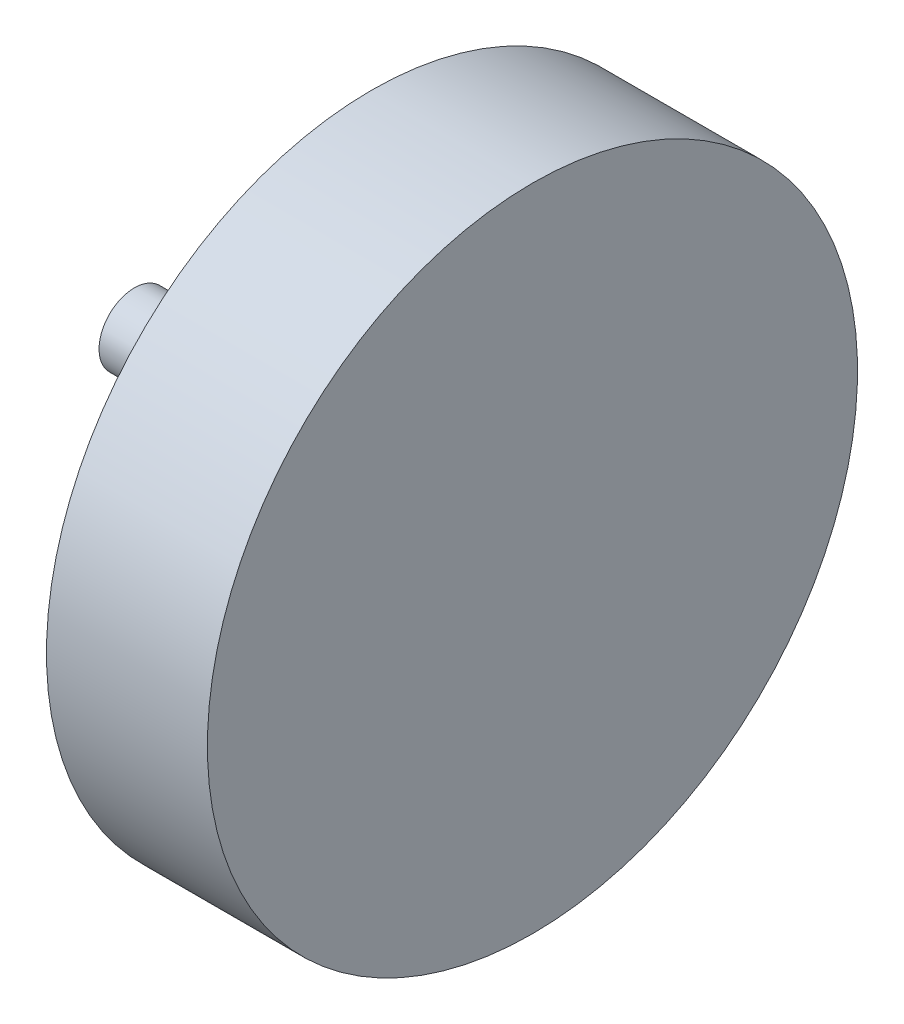
from build123d import *


with BuildPart() as part:
    # Sketch1 → Revolve2 (revolve)
    with BuildSketch(Plane.XY):
        Polygon((72.797045256, 15.24), (85.497045256, 15.24), (187.097045256, 42.463637951), (187.097045256, 256.54), (314.097045256, 256.54), (314.097045256, 0), (0, 0), (0, 27.94), (50.8, 27.94), align=None)
    revolve(axis=Axis((314.097045256, 0, 0), (-1, 0, 0)))


solid = part.part
